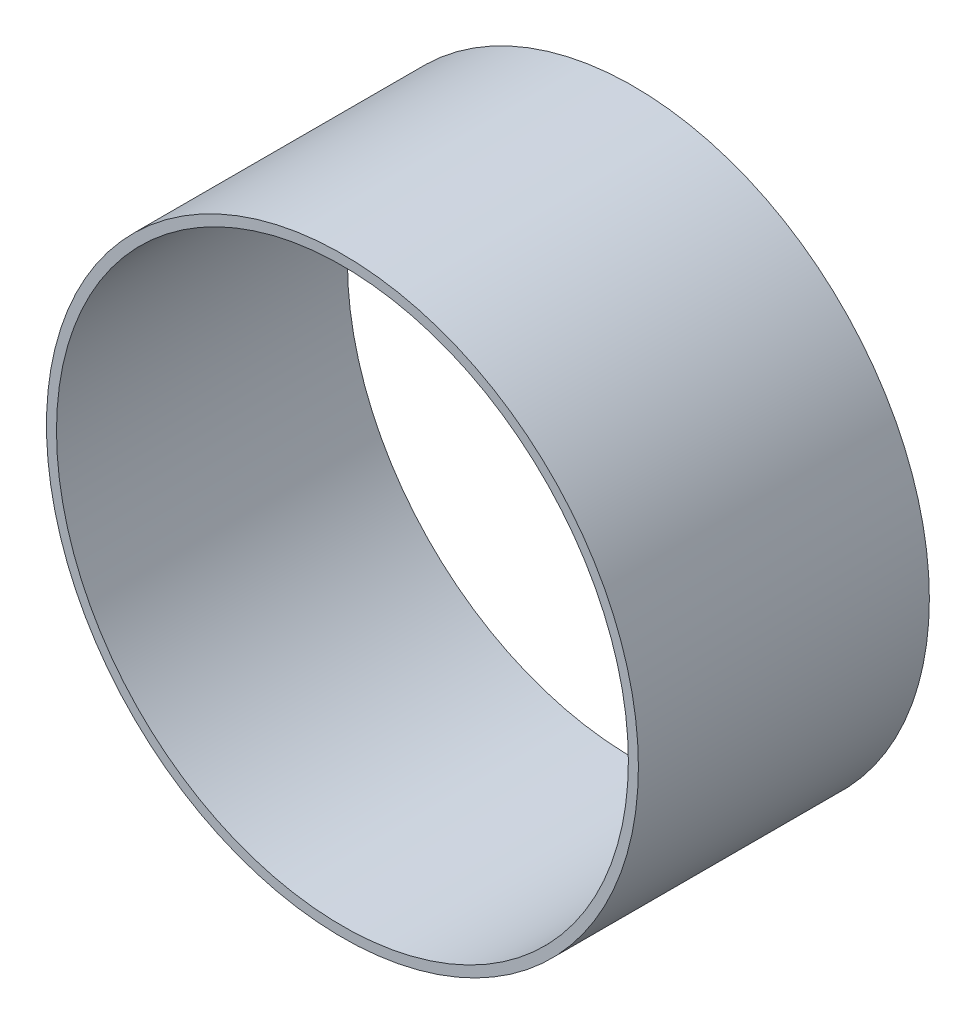
from build123d import *

# Parameters (mm, degrees)
RIM_REFERENCE_START = -39.5
SKETCH_1_R          = 88.5
SKETCH_1_R_2        = 85.5
RIM_REFERENCE_DEPTH = 87


with BuildPart() as part:
    # Эскиз1 → Rim_reference (new body)
    with BuildSketch(Plane.XY.offset(RIM_REFERENCE_START)):
        Circle(SKETCH_1_R)
        Circle(SKETCH_1_R_2, mode=Mode.SUBTRACT)
    extrude(amount=RIM_REFERENCE_DEPTH)


solid = part.part
